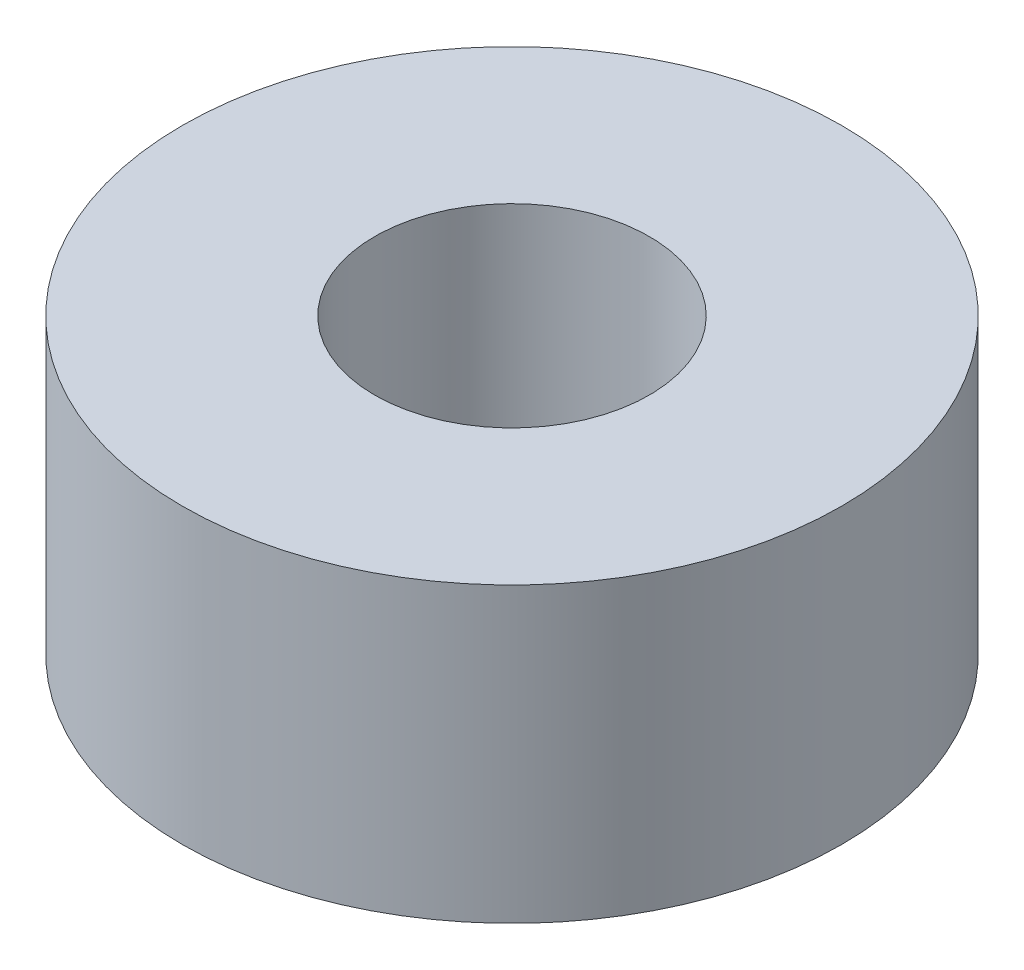
from build123d import *

# Parameters (mm, degrees)
SKETCH1_R           = 18
SKETCH1_R_2         = 7.5
BOSS_EXTRUDE1_DEPTH = 16


with BuildPart() as part:
    # Sketch1 → Boss-Extrude1 (new body)
    with BuildSketch(Plane(origin=(0, 0, 0), x_dir=(1, 0, 0), z_dir=(0, 1, 0))):
        with Locations(Location((0, 0, 0), (0, 0, 270))):
            Circle(SKETCH1_R)
        with Locations(Location((0, 0, 0), (0, 0, 270))):
            Circle(SKETCH1_R_2, mode=Mode.SUBTRACT)
    extrude(amount=BOSS_EXTRUDE1_DEPTH)


solid = part.part
